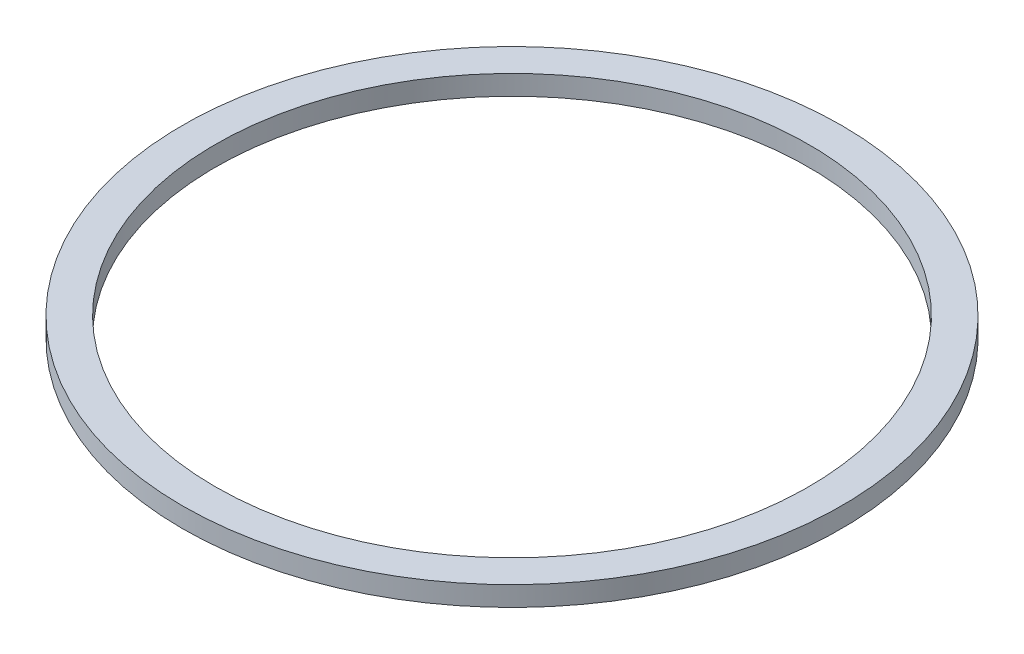
from build123d import *

# Parameters (mm, degrees)
IZIM1_R                     = 50
IZIM1_R_2                   = 45
Y_KSEKLIK_EKSTR_ZYON1_DEPTH = 3


with BuildPart() as part:
    # Çizim1 → Yükseklik-Ekstrüzyon1 (new body)
    with BuildSketch(Plane(origin=(0, 0, 0), x_dir=(1, 0, 0), z_dir=(0, 1, 0))):
        with Locations(Location((0, 0, 0), (0, 0, 270))):
            Circle(IZIM1_R)
        with Locations(Location((0, 0, 0), (0, 0, 270))):
            Circle(IZIM1_R_2, mode=Mode.SUBTRACT)
    extrude(amount=Y_KSEKLIK_EKSTR_ZYON1_DEPTH)


solid = part.part
